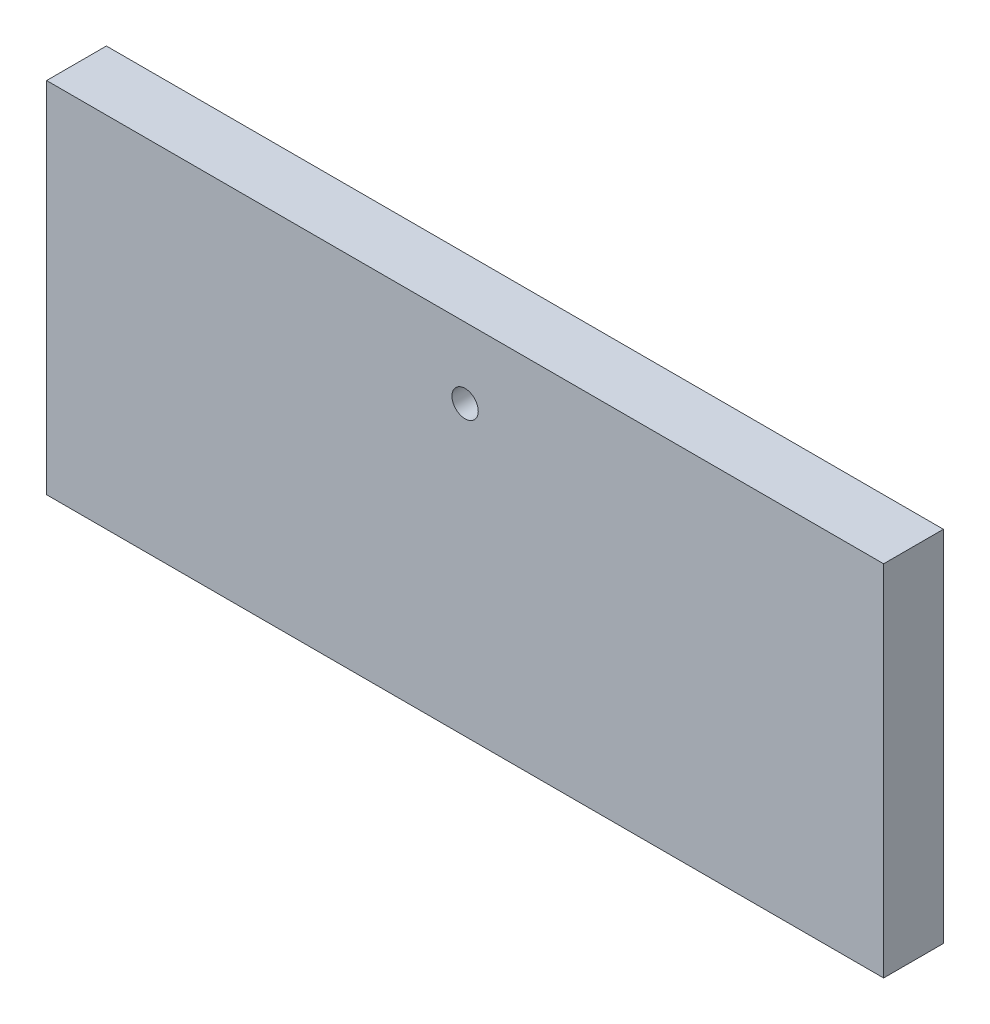
from build123d import *

# Parameters (mm, degrees)
SKETCH1_W               = 700
SKETCH1_H               = 300
BOSS_EXTRUDE1_DEPTH     = 25
CUT_EXTRUDE1_DEPTH      = 462.654632815
CUT_EXTRUDE1_DEPTH_BACK = 462.654632815
SKETCH2_R               = 11


with BuildPart() as part:
    # Sketch1 → Boss-Extrude1 (new, symmetric)
    with BuildSketch(Plane.XY):
        with Locations((0, 150)):
            Rectangle(SKETCH1_W, SKETCH1_H)
    extrude(amount=BOSS_EXTRUDE1_DEPTH, both=True)

    # Sketch2 → Cut-Extrude1 (cut, two sides: drawn at the far end of the back side and taken through both)
    with BuildSketch(Plane.XY.offset(-CUT_EXTRUDE1_DEPTH_BACK)):
        with Locations((0, 241)):
            Circle(SKETCH2_R)
    extrude(amount=CUT_EXTRUDE1_DEPTH + CUT_EXTRUDE1_DEPTH_BACK, mode=Mode.SUBTRACT)


solid = part.part
